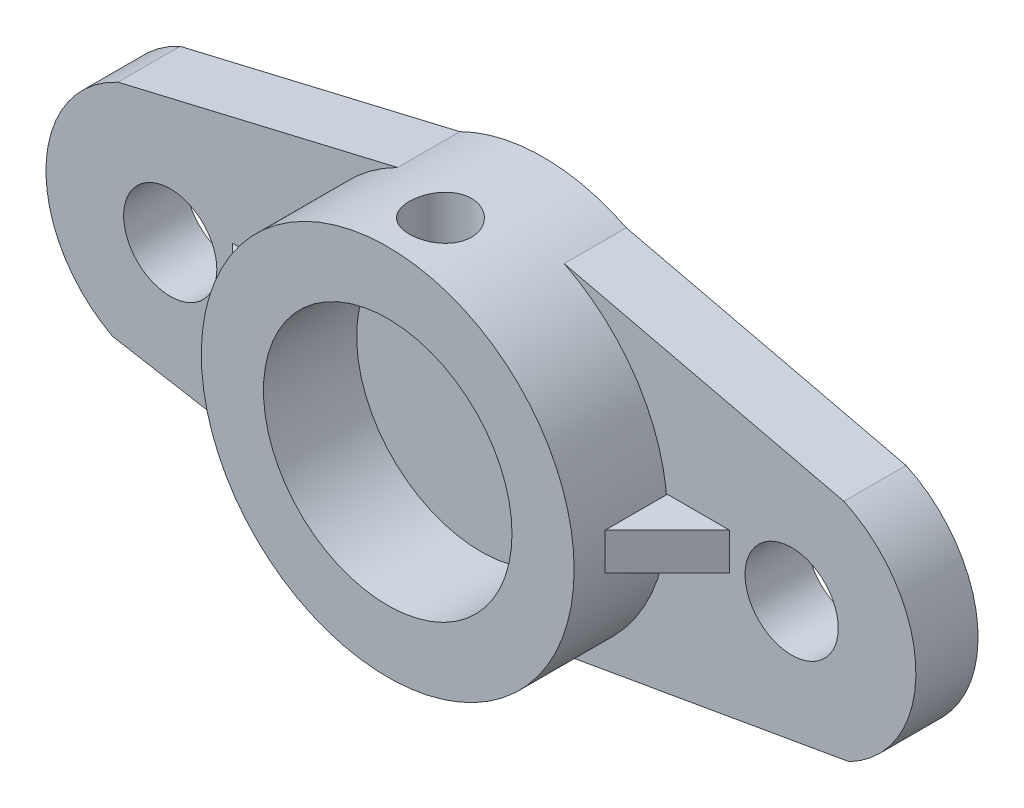
from build123d import *
from build123d.topology import SkipClean

# Parameters (mm, degrees)
SKETCH1_R             = 7.5
BOSS_EXTRUDE1_DEPTH   = 10
SKETCH2_R             = 30
SKETCH2_R_2           = 20
BOSS_EXTRUDE2_DEPTH   = 15
BOSS_EXTRUDE9_DEPTH   = 3
BOSS_EXTRUDE9_2_DEPTH = 3
SKETCH9_R             = 5
CUT_EXTRUDE1_DEPTH    = 12


with BuildPart() as part:
    # Sketch1 → Boss-Extrude1 (new body)
    with BuildSketch(Plane.XY):
        with BuildLine():
            Line((-59.27364878, -19.637458905), (-10.178432842, -28.220551109))
            ThreePointArc((-10.178432842, -28.220551109), (0, -30), (10.178432842, -28.220551109))
            Line((10.178432842, -28.220551109), (59.27364878, -19.637458905))
            ThreePointArc((59.27364878, -19.637458905), (69.994245494, -1.437693094), (58.413127348, 16.226971408))
            Line((58.413127348, 16.226971408), (13.402098279, 26.839965755))
            ThreePointArc((13.402098279, 26.839965755), (0, 30), (-13.402098279, 26.839965755))
            Line((-13.402098279, 26.839965755), (-58.413127348, 16.226971408))
            ThreePointArc((-58.413127348, 16.226971408), (-69.994245494, -1.437693094), (-59.27364878, -19.637458905))
        make_face()
        with Locations((-50, -1.917429608)):
            Circle(SKETCH1_R, mode=Mode.SUBTRACT)
        with Locations((50, -1.917429608)):
            Circle(SKETCH1_R, mode=Mode.SUBTRACT)
    extrude(amount=BOSS_EXTRUDE1_DEPTH)

    # Sketch2 → Boss-Extrude2 (add)
    with BuildSketch(Plane.XY.offset(10)):
        with Locations(Location((0, 0, 0), (0, 0, 116.534500166))):
            Circle(SKETCH2_R)
        Circle(SKETCH2_R_2, mode=Mode.SUBTRACT)
    extrude(amount=BOSS_EXTRUDE2_DEPTH)

    # Sketch9 → Cut-Extrude1 (cut)
    with SkipClean():  # the faces are left unmerged after this step: merging them gives an invalid solid
        with BuildSketch(Plane(origin=(0, 30, 0), x_dir=(1, 0, 0), z_dir=(0, 1, 0))):
            with Locations(Location((0, -16.517299194, 0), (0, 0, 270))):
                Circle(SKETCH9_R)
        extrude(amount=-CUT_EXTRUDE1_DEPTH, mode=Mode.SUBTRACT)


with BuildPart() as body_2:
    # Sketch7 → Boss-Extrude9 (new, symmetric)
    with BuildSketch(Plane(origin=(0, 0, 0), x_dir=(1, 0, 0), z_dir=(0, 1, 0))):
        Polygon((-30, -10), (-30, -20), (-40, -10), align=None)
    extrude(amount=BOSS_EXTRUDE9_DEPTH, both=True)


with BuildPart() as body_3:
    # Sketch7 → Boss-Extrude9 2 (new, symmetric)
    with BuildSketch(Plane(origin=(0, 0, 0), x_dir=(1, 0, 0), z_dir=(0, 1, 0))):
        Polygon((30, -20), (40, -10), (30, -10), align=None)
    extrude(amount=BOSS_EXTRUDE9_2_DEPTH, both=True)


solid = Compound([part.part, body_2.part, body_3.part])
